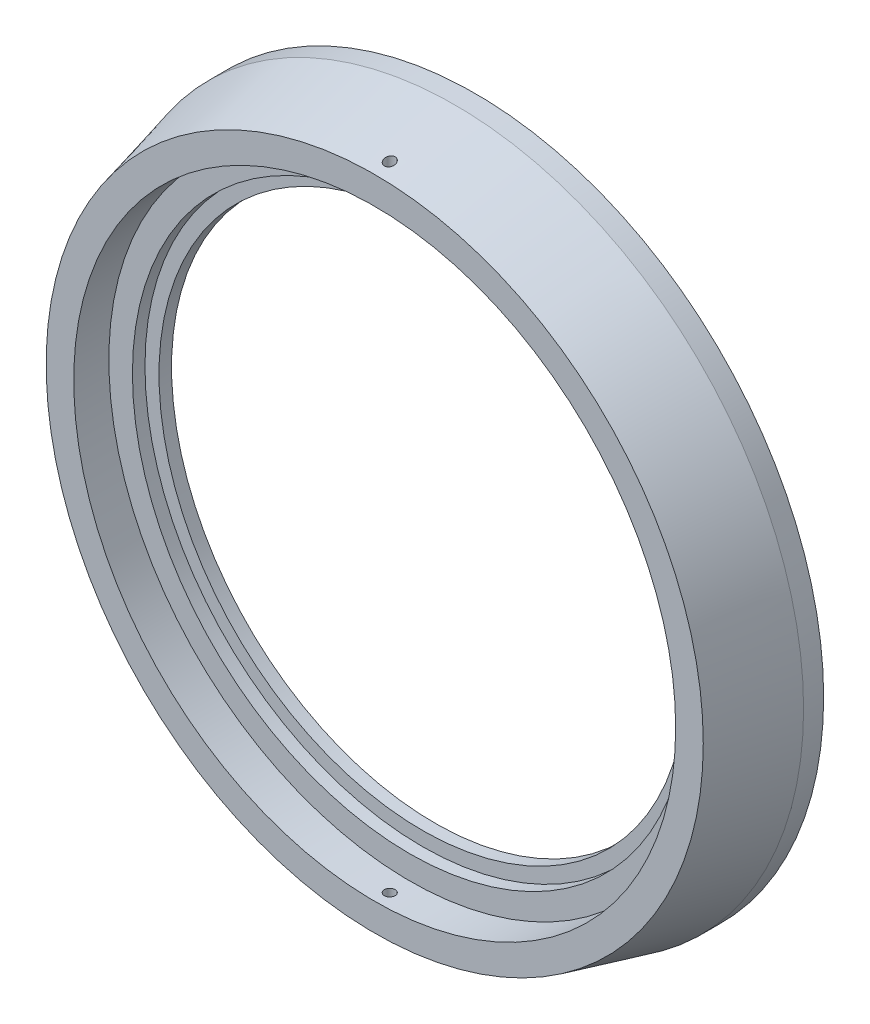
from build123d import *

# Parameters (mm, degrees)
SKETCH1_R               = 88.265
BOSS_EXTRUDE1_DEPTH     = 25.4
SKETCH2_R               = 76.2
CUT_EXTRUDE1_DEPTH      = 8.89
SKETCH3_R               = 70.231
CUT_EXTRUDE2_DEPTH      = 3.175
SKETCH4_R               = 66.675
CUT_EXTRUDE3_DEPTH      = 126.535822278
CHAMFER1_SIZE           = 10.16
CHAMFER1_SIZE2          = 18.415
CHAMFER2_SIZE           = 20.32
CHAMFER2_SIZE2          = 5.08
CUT_EXTRUDE4_DEPTH      = 128.383595686
CUT_EXTRUDE4_DEPTH_BACK = 128.383595686
SKETCH5_R               = 1.35255


with BuildPart() as part:
    # Sketch1 → Boss-Extrude1 (new body)
    with BuildSketch(Plane.XY):
        Circle(SKETCH1_R)
    extrude(amount=BOSS_EXTRUDE1_DEPTH)

    # Sketch2 → Cut-Extrude1 (cut)
    with BuildSketch(Plane.XY.offset(25.4)):
        Circle(SKETCH2_R)
    extrude(amount=-CUT_EXTRUDE1_DEPTH, mode=Mode.SUBTRACT)

    # Sketch3 → Cut-Extrude2 (cut)
    with BuildSketch(Plane.XY.offset(16.51)):
        Circle(SKETCH3_R)
    extrude(amount=-CUT_EXTRUDE2_DEPTH, mode=Mode.SUBTRACT)

    # Sketch4 → Cut-Extrude3 (cut, through all)
    with BuildSketch(Plane.XY.offset(13.335)):
        Circle(SKETCH4_R)
    extrude(amount=-CUT_EXTRUDE3_DEPTH, mode=Mode.SUBTRACT)

    # Chamfer1
    chamfer1_edges = [part.edges().sort_by_distance(p)[0] for p in [
        (-66.675, 0, 0),
    ]]
    chamfer1_side = [part.faces().sort_by_distance(p)[0] for p in [
        (-66.675, 0, 6.6675),
    ]]
    chamfer(chamfer1_edges, length=CHAMFER1_SIZE, length2=CHAMFER1_SIZE2, reference=chamfer1_side[0])

    # Chamfer2
    chamfer2_edges = [part.edges().sort_by_distance(p)[0] for p in [
        (-88.265, 0, 25.4),
    ]]
    chamfer2_side = [part.faces().sort_by_distance(p)[0] for p in [
        (-88.265, 0, 12.7),
    ]]
    chamfer(chamfer2_edges, length=CHAMFER2_SIZE, length2=CHAMFER2_SIZE2, reference=chamfer2_side[0])

    # Sketch5 → Cut-Extrude4 (cut, two sides: drawn at the far end of the back side and taken through both)
    with BuildSketch(Plane(origin=(0, 0, 0), x_dir=(1, 0, 0), z_dir=(0, 1, 0)).offset(-CUT_EXTRUDE4_DEPTH_BACK)):
        with Locations(Location((0, -21.59, 0), (0, 0, 270))):
            Circle(SKETCH5_R)
    extrude(amount=CUT_EXTRUDE4_DEPTH + CUT_EXTRUDE4_DEPTH_BACK, mode=Mode.SUBTRACT)


solid = part.part
